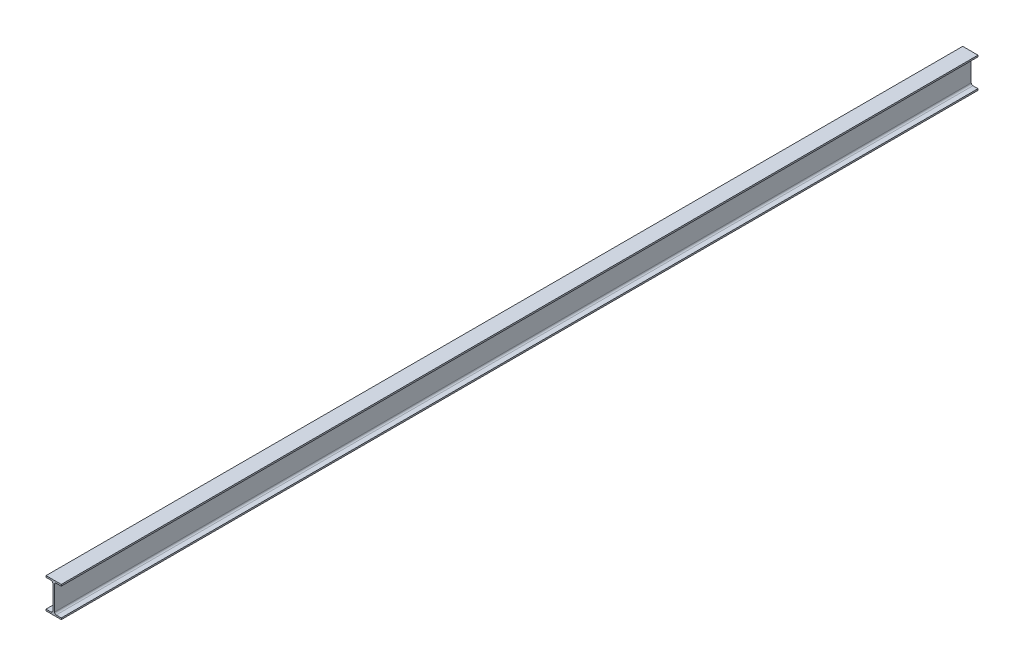
from build123d import *

# Parameters (mm, degrees)
BOSS_EXTRUDE1_DEPTH = 3000


with BuildPart() as part:
    # Sketch1 → Boss-Extrude1 (new, symmetric)
    with BuildSketch(Plane.XY):
        with BuildLine():
            Line((5.7, 0), (5.7, 79))
            ThreePointArc((5.7, 79), (8.921825407, 86.778174593), (16.7, 90))
            Line((16.7, 90), (50, 90))
            Line((50, 90), (50, 100))
            Line((50, 100), (-50, 100))
            Line((-50, 100), (-50, 90))
            Line((-50, 90), (-16.7, 90))
            ThreePointArc((-16.7, 90), (-8.921825407, 86.778174593), (-5.7, 79))
            Line((-5.7, 79), (-5.7, 0))
            Line((-5.7, 0), (-5.7, -79))
            ThreePointArc((-5.7, -79), (-8.921825407, -86.778174593), (-16.7, -90))
            Line((-16.7, -90), (-50, -90))
            Line((-50, -90), (-50, -100))
            Line((-50, -100), (50, -100))
            Line((50, -100), (50, -90))
            Line((50, -90), (16.7, -90))
            ThreePointArc((16.7, -90), (8.921825407, -86.778174593), (5.7, -79))
            Line((5.7, -79), (5.7, 0))
        make_face()
    extrude(amount=BOSS_EXTRUDE1_DEPTH, both=True)


solid = part.part
